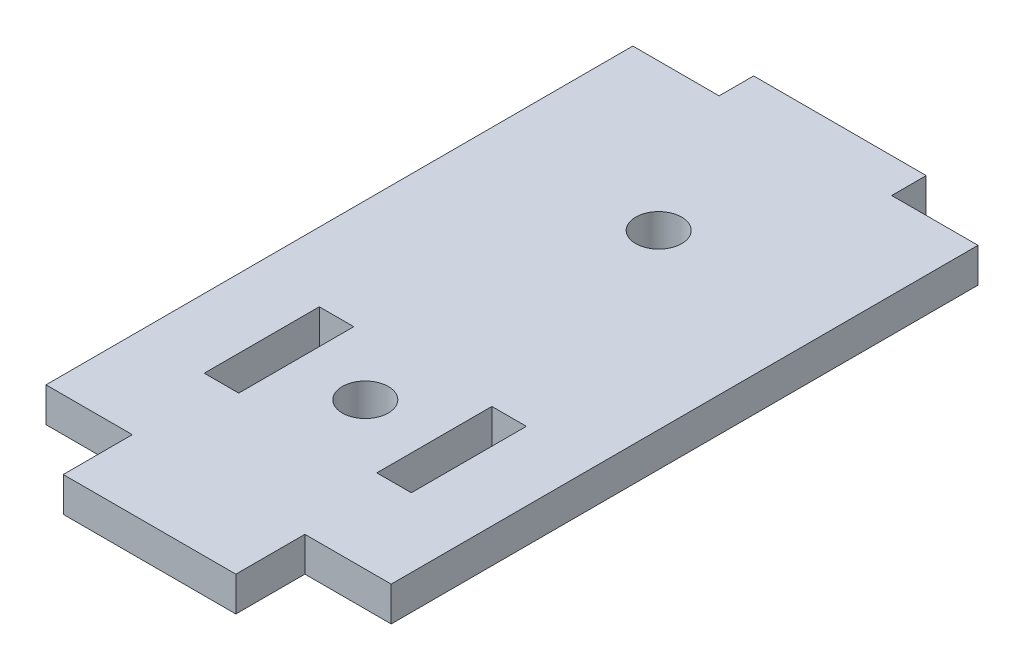
from build123d import *

# Parameters (mm, degrees)
SKETCH1_W           = 7.5
SKETCH1_H           = 6
BOSS_EXTRUDE1_DEPTH = 3


with BuildPart() as part:
    # Sketch1 → Boss-Extrude1 (new body)
    with BuildSketch(Plane(origin=(0, 0, 0), x_dir=(1, 0, 0), z_dir=(0, 1, 0))):
        with BuildLine():
            Line((0, 14.75), (0, 25.5))
            Line((0, 25.5), (-7.5, 25.5))
            Line((-7.5, 25.5), (-15, 25.5))
            Line((-15, 25.5), (-15, -12.75))
            Line((-15, -12.75), (-9, -12.75))
            Line((-9, -12.75), (-9, -7.75))
            Line((-9, -7.75), (-6, -7.75))
            Line((-6, -7.75), (-6, -12.75))
            Line((-6, -12.75), (-2, -12.75))
            ThreePointArc((-2, -12.75), (-1.414213562, -11.335786438), (0, -10.75))
            Line((0, -10.75), (0, 0))
            Line((0, 0), (0, 10.75))
            ThreePointArc((0, 10.75), (-2, 12.75), (0, 14.75))
        make_face()
        with BuildLine():
            Line((-9, -12.75), (-15, -12.75))
            Line((-15, -12.75), (-15, -25.5))
            Line((-15, -25.5), (-7.5, -25.5))
            Line((-7.5, -25.5), (0, -25.5))
            Line((0, -25.5), (0, -14.75))
            ThreePointArc((0, -14.75), (-1.414213562, -14.164213562), (-2, -12.75))
            Line((-2, -12.75), (-6, -12.75))
            Line((-6, -12.75), (-6, -17.75))
            Line((-6, -17.75), (-9, -17.75))
            Line((-9, -17.75), (-9, -12.75))
        make_face()
        with BuildLine():
            Line((15, -25.5), (15, -12.75))
            Line((15, -12.75), (9, -12.75))
            Line((9, -12.75), (9, -17.75))
            Line((9, -17.75), (6, -17.75))
            Line((6, -17.75), (6, -12.75))
            Line((6, -12.75), (2, -12.75))
            ThreePointArc((2, -12.75), (1.414213562, -14.164213562), (0, -14.75))
            Line((0, -14.75), (0, -25.5))
            Line((0, -25.5), (7.5, -25.5))
            Line((7.5, -25.5), (15, -25.5))
        make_face()
        with BuildLine():
            Line((7.5, 25.5), (0, 25.5))
            Line((0, 25.5), (0, 14.75))
            ThreePointArc((0, 14.75), (1.414213562, 14.164213562), (2, 12.75))
            ThreePointArc((2, 12.75), (1.414213562, 11.335786438), (0, 10.75))
            Line((0, 10.75), (0, 0))
            Line((0, 0), (0, -10.75))
            ThreePointArc((0, -10.75), (1.414213562, -11.335786438), (2, -12.75))
            Line((2, -12.75), (6, -12.75))
            Line((6, -12.75), (6, -7.75))
            Line((6, -7.75), (9, -7.75))
            Line((9, -7.75), (9, -12.75))
            Line((9, -12.75), (15, -12.75))
            Line((15, -12.75), (15, 25.5))
            Line((15, 25.5), (7.5, 25.5))
        make_face()
        Polygon((-7.5, 25.5), (0, 25.5), (7.5, 25.5), (7.5, 28.5), (-7.5, 28.5), align=None)
        Polygon((-7.5, 25.5), (0, 25.5), (7.5, 25.5), (7.5, 28.5), (-7.5, 28.5), align=None)
        with Locations((-3.75, -28.5)):
            Rectangle(SKETCH1_W, SKETCH1_H)
        with Locations((3.75, -28.5)):
            Rectangle(SKETCH1_W, SKETCH1_H)
    extrude(amount=BOSS_EXTRUDE1_DEPTH)


solid = part.part
